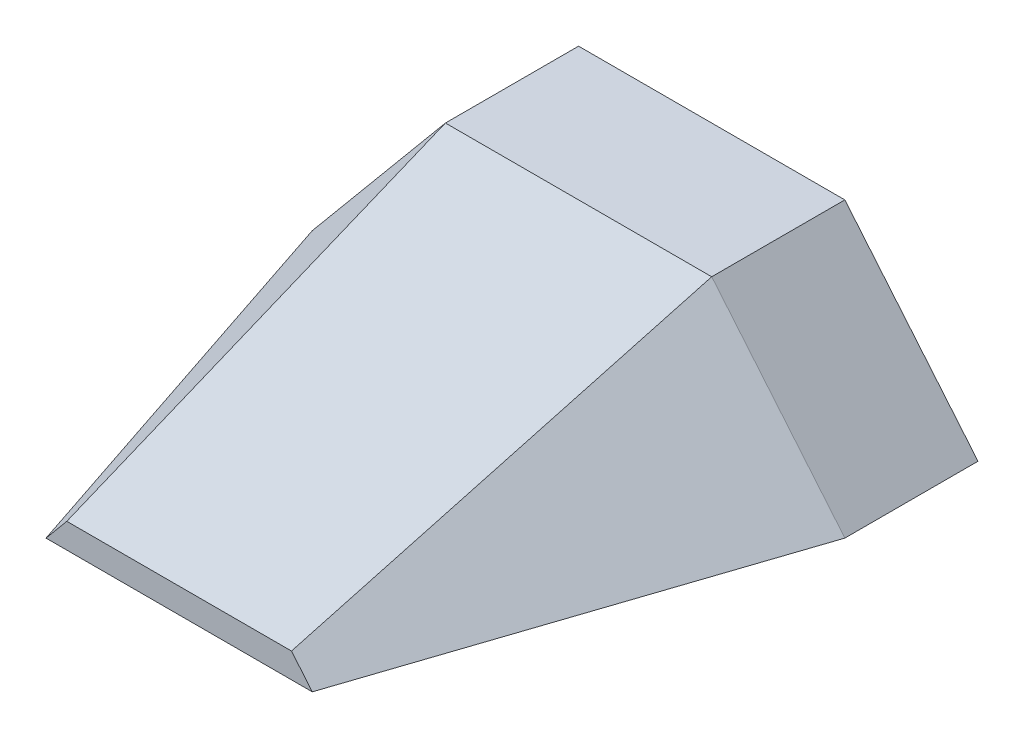
from build123d import *

# Parameters (mm, degrees)
BOSS_EXTRUDE1_DEPTH = 8
SHELL1_T            = -1.6


with BuildPart() as part:
    # Sketch1 → Boss-Extrude1 (new body)
    with BuildSketch(Plane.XY):
        Polygon((-8, 9.6), (8, 9.6), (16, 0), (-16, 0), align=None)
    extrude(amount=BOSS_EXTRUDE1_DEPTH)

    # Sketch2 → section 1 of loft1
    with BuildSketch(Plane.XY.offset(32), mode=Mode.PRIVATE) as loft1_s1:
        with BuildLine():
            Line((-8, 0), (8, 0))
            Line((8, 0), (6.75, 1.5))
            Line((6.75, 1.5), (-6.75, 1.5))
            Line((-6.75, 1.5), (-8, 0))
        make_face()
    # loft from a face of the part (loft1)
    loft([part.faces().sort_by_distance((0, 4.266666667, 8))[0], loft1_s1.sketch])

    # Shell1
    shell1_openings = [part.faces().sort_by_distance(p)[0] for p in [
        (0, 0, 14.153846154),
    ]]
    offset(amount=SHELL1_T, openings=shell1_openings)


solid = part.part
